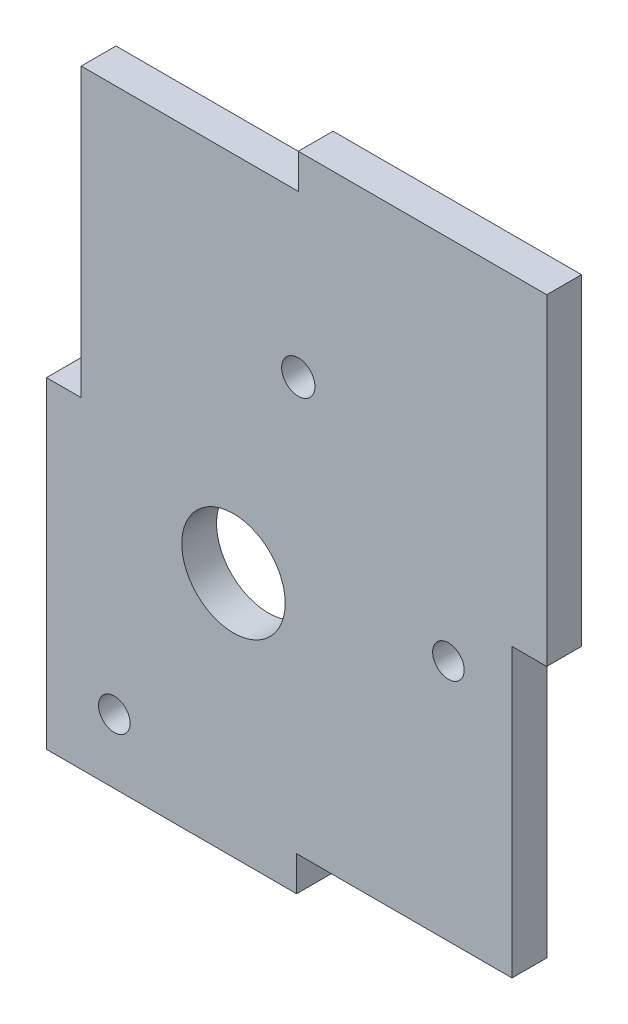
from build123d import *

# Parameters (mm, degrees)
BACKSKETCH_W        = 38.1
BACKSKETCH_H        = 50.8
BACKSKETCH_R        = 1.4732
BACKSKETCH_R_2      = 4.572
BACKSKETCH_R_3      = 1.397
BOSS_EXTRUDE1_DEPTH = 3.0734


with BuildPart() as part:
    # backSketch → Boss-Extrude1 (new body)
    # profile 1 of 3: a face of its own
    with BuildSketch(Plane.XY):
        Polygon((38.1, 50.8), (38.1, 25.4), (41.1734, 25.4), (41.1734, 53.8734), (19.196716748, 53.8734), (19.196716748, 50.8), align=None)
    # profile 2 of 3: a face of its own
    with BuildSketch(Plane.XY):
        Polygon((19.05, 0), (0, 0), (0, 25.4), (-3.0734, 25.4), (-3.0734, -3.0734), (19.05, -3.0734), align=None)
    # profile 3 of 3: a face of its own
    with BuildSketch(Plane.XY):
        with Locations((19.05, 25.4)):
            Rectangle(BACKSKETCH_W, BACKSKETCH_H)
        with Locations((19.196716748, 36.578509469)):
            Circle(BACKSKETCH_R, mode=Mode.SUBTRACT)
        with Locations((13.465150567, 18.677705992)):
            Circle(BACKSKETCH_R_2, mode=Mode.SUBTRACT)
        with Locations((32.475268488, 21.466248377)):
            Circle(BACKSKETCH_R_3, mode=Mode.SUBTRACT)
        with Locations((2.925293214, 2.613087759)):
            Circle(BACKSKETCH_R_3, mode=Mode.SUBTRACT)
    extrude(amount=BOSS_EXTRUDE1_DEPTH)


solid = part.part
